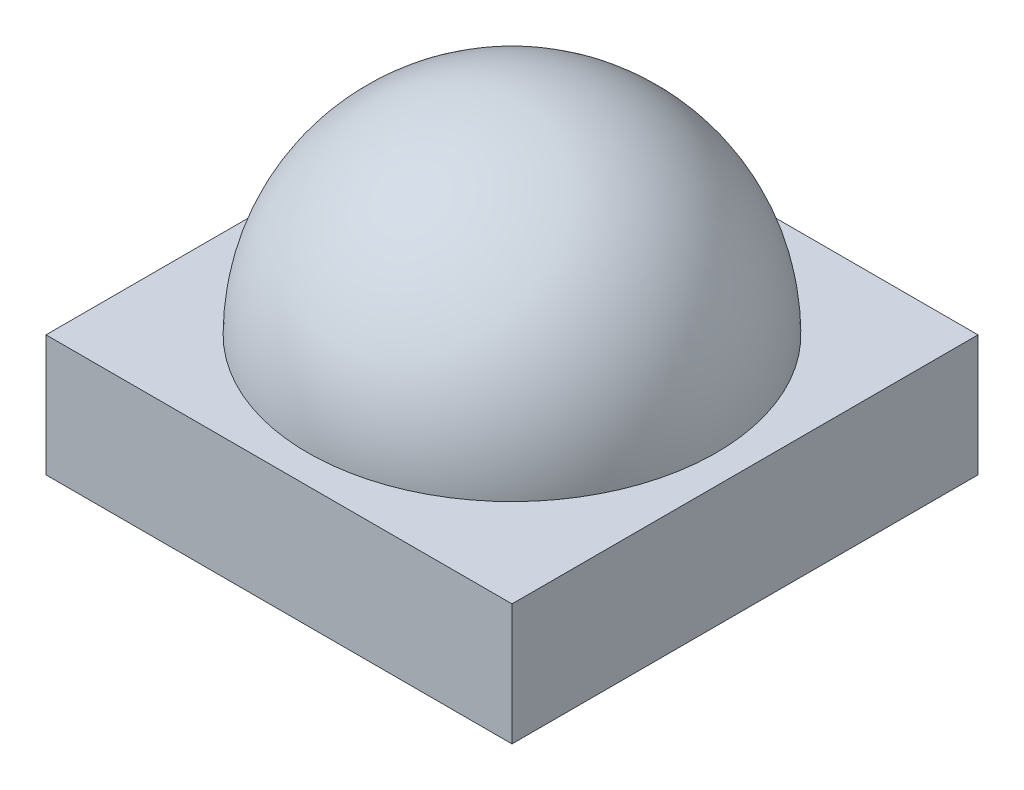
from build123d import *

# Parameters (mm, degrees)
SKETCH1_W           = 3.65
SKETCH1_H           = 3.65
BOSS_EXTRUDE1_DEPTH = 0.95
REVOLVE1_ANGLE      = 180


with BuildPart() as part:
    # Sketch1 → Boss-Extrude1 (new body)
    with BuildSketch(Plane(origin=(0, 0, 0), x_dir=(1, 0, 0), z_dir=(0, 1, 0))):
        Rectangle(SKETCH1_W, SKETCH1_H)
    extrude(amount=BOSS_EXTRUDE1_DEPTH)

    # Sketch2 → Revolve1 (revolve)
    with BuildSketch(Plane(origin=(0, 0.95, 0), x_dir=(1, 0, 0), z_dir=(0, 1, 0))):
        with BuildLine():
            Line((0, 1.6), (0, -1.6))
            ThreePointArc((0, -1.6), (1.6, 0), (0, 1.6))
        make_face()
    revolve(axis=Axis((0, 0.95, -1.6), (0, 0, 1)), revolution_arc=REVOLVE1_ANGLE)


solid = part.part
